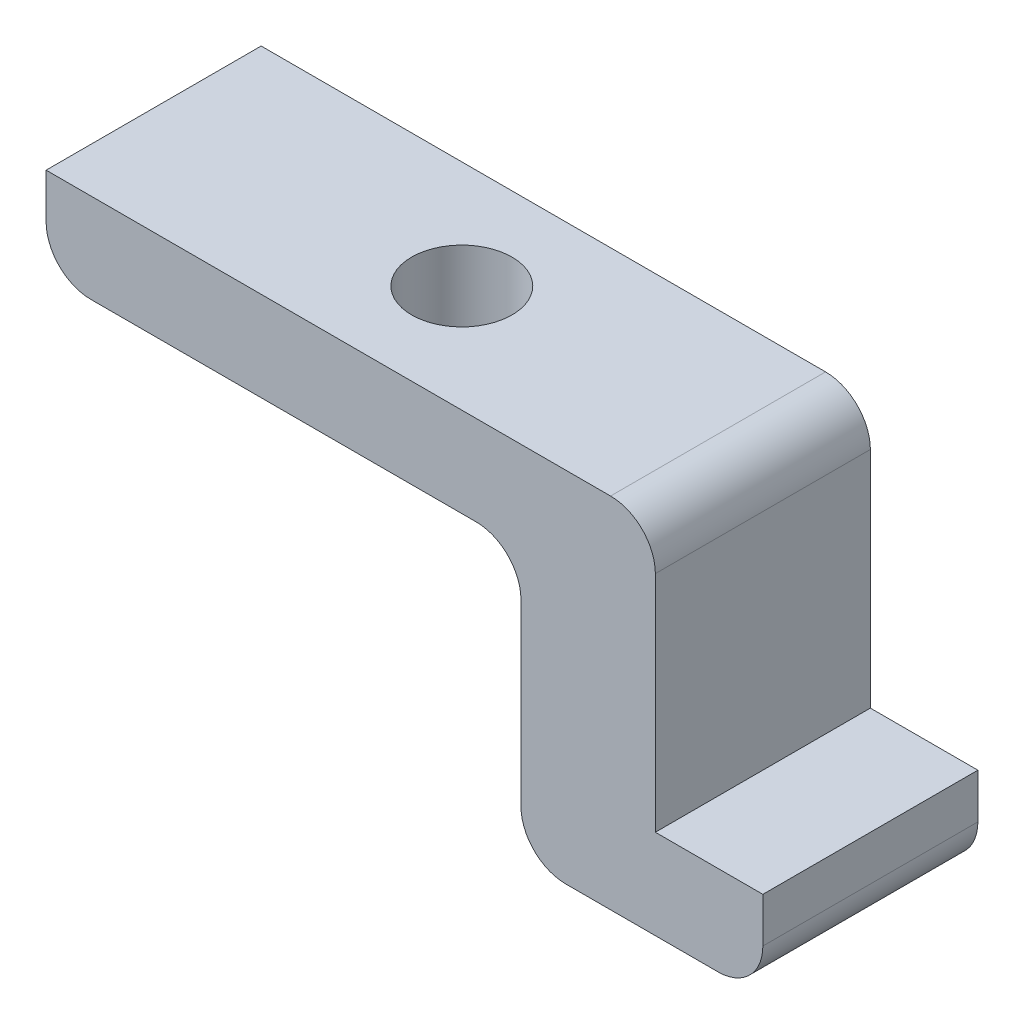
from build123d import *

# Parameters (mm, degrees)
BOSS_EXTRUDE1_DEPTH = 7.62
SKETCH2_R           = 1.778
CUT_EXTRUDE1_DEPTH  = 27.181720723
FILLET1_R           = 1.5875


with BuildPart() as part:
    # Sketch1 → Boss-Extrude1 (new body)
    with BuildSketch(Plane.XY):
        Polygon((0, 0), (0, 9.525), (-21.59, 9.525), (-21.59, 6.35), (-4.7625, 6.35), (-4.7625, -3.175), (3.81, -3.175), (3.81, 0), align=None)
    extrude(amount=BOSS_EXTRUDE1_DEPTH)

    # Sketch2 → Cut-Extrude1 (cut, through all)
    with BuildSketch(Plane(origin=(0, 9.525, 0), x_dir=(1, 0, 0), z_dir=(0, 1, 0))):
        with Locations(Location((-10.668, -3.81, 0), (0, 0, 180))):
            Circle(SKETCH2_R)
    extrude(amount=-CUT_EXTRUDE1_DEPTH, mode=Mode.SUBTRACT)

    # Fillet1
    fillet1_edges = [part.edges().sort_by_distance(p)[0] for p in [
        (-4.7625, -3.175, 3.81),
        (-4.7625, 6.35, 3.81),
        (-21.59, 6.35, 3.81),
        (0, 9.525, 3.81),
        (3.81, -3.175, 3.81),
    ]]
    fillet(fillet1_edges, radius=FILLET1_R)


solid = part.part
